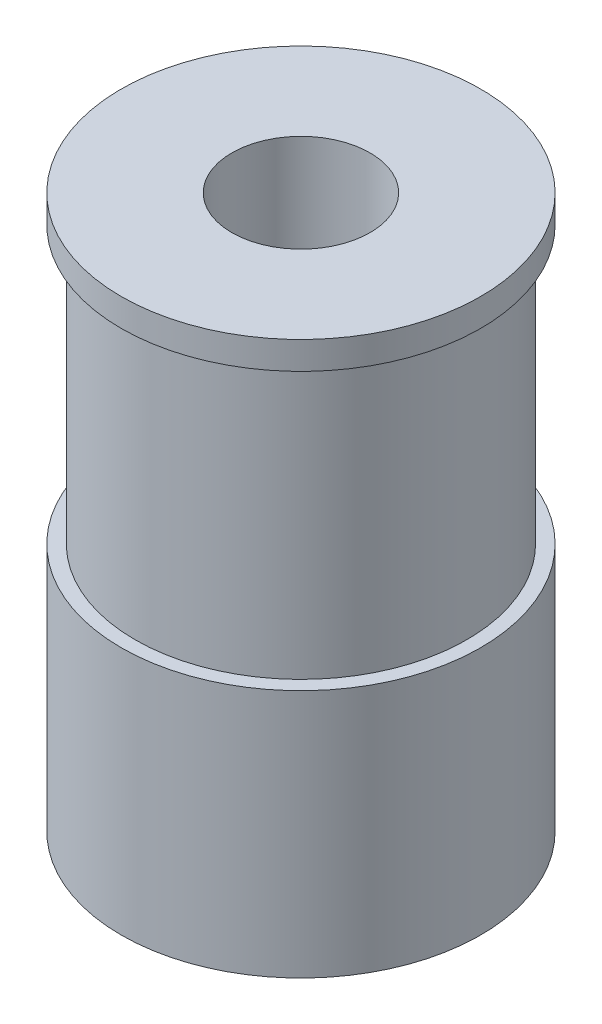
from build123d import *

# Parameters (mm, degrees)
SKETCH1_R           = 6.5
SKETCH1_R_2         = 2.5
BOSS_EXTRUDE1_DEPTH = 20
SKETCH2_R           = 6.793151268
SKETCH2_R_2         = 6
CUT_EXTRUDE1_DEPTH  = 10


with BuildPart() as part:
    # Sketch1 → Boss-Extrude1 (new body)
    with BuildSketch(Plane(origin=(0, 0, 0), x_dir=(1, 0, 0), z_dir=(0, 1, 0))):
        with Locations(Location((0, 0, 0), (0, 0, 270))):
            Circle(SKETCH1_R)
        with Locations(Location((0, 0, 0), (0, 0, 270))):
            Circle(SKETCH1_R_2, mode=Mode.SUBTRACT)
    extrude(amount=BOSS_EXTRUDE1_DEPTH)

    # Sketch2 → Cut-Extrude1 (cut)
    with BuildSketch(Plane(origin=(0, 19, 0), x_dir=(1, 0, 0), z_dir=(0, 1, 0))):
        Circle(SKETCH2_R)
        with Locations(Location((0, 0, 0), (0, 0, 270))):
            Circle(SKETCH2_R_2, mode=Mode.SUBTRACT)
    extrude(amount=-CUT_EXTRUDE1_DEPTH, mode=Mode.SUBTRACT)


solid = part.part
